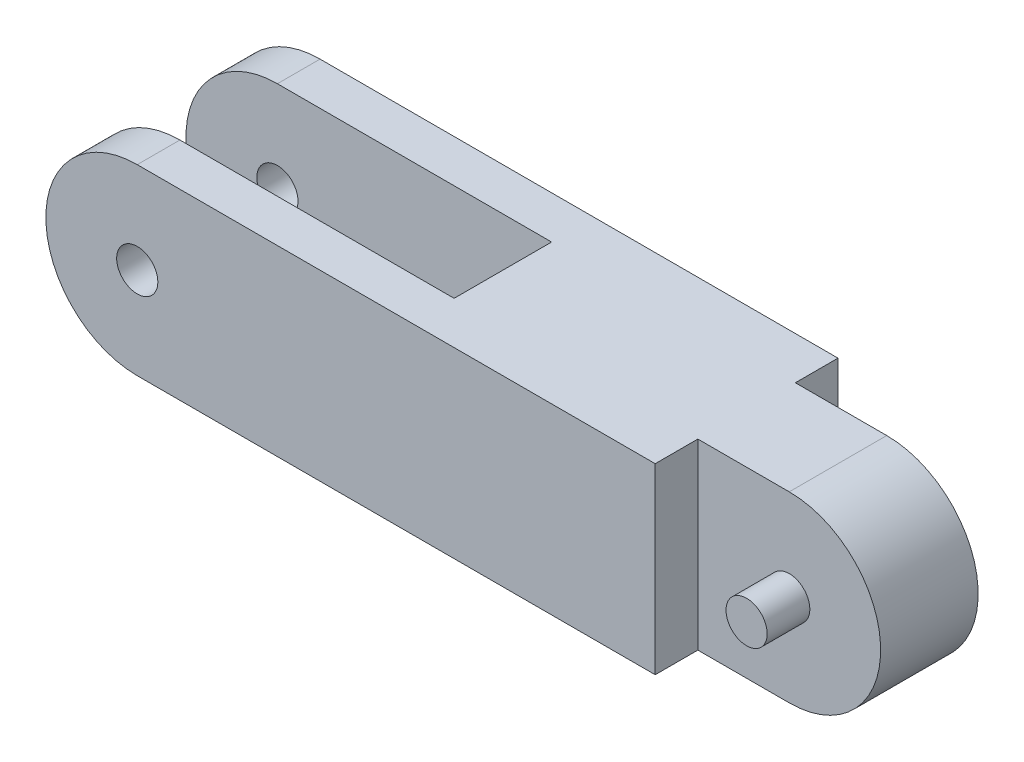
from build123d import *

# Parameters (mm, degrees)
BOSS_EXTRUDE1_DEPTH             = 15
H_0_266_DIAMETER_HOLE1_D        = 6.7564
SKETCH5_W                       = 60
SKETCH5_H                       = 16
SKETCH5_H_2                     = 20.916111238
CUT_EXTRUDE1_DEPTH              = 74.143694192
BOSS_EXTRUDE2_REACH             = 70.374
SKETCH6_R                       = 3.3782
BOSS_EXTRUDE2_DIRECTION_2_REACH = 70.374


with BuildPart() as part:
    # Sketch1 → Boss-Extrude1 (new, symmetric)
    with BuildSketch(Plane.XY):
        with BuildLine():
            Line((-50, 15), (50, 15))
            ThreePointArc((50, 15), (65, 0), (50, -15))
            Line((50, -15), (-50, -15))
            ThreePointArc((-50, -15), (-65, 0), (-50, 15))
        make_face()
    extrude(amount=BOSS_EXTRUDE1_DEPTH, both=True)

    # H (0.266) Diameter Hole1 (through all)
    with Locations(Plane.XY.offset(15)):
        with Locations((-50, 0), (50, 0)):
            Hole(H_0_266_DIAMETER_HOLE1_D / 2)

    # Sketch5 → Cut-Extrude1 (cut, through all)
    with BuildSketch(Plane(origin=(0, 15, 0), x_dir=(1, 0, 0), z_dir=(0, 1, 0))):
        with Locations((-35, 0)):
            Rectangle(SKETCH5_W, SKETCH5_H)
        with Locations((65, 18.458055619)):
            Rectangle(SKETCH5_W, SKETCH5_H_2)
        with Locations((65, -18.458055619)):
            Rectangle(SKETCH5_W, SKETCH5_H_2)
    extrude(amount=-CUT_EXTRUDE1_DEPTH, mode=Mode.SUBTRACT)

    # Boss-Extrude2: up to this face of the body (flat: up to its plane)
    boss_extrude2_end = Plane(part.part.faces().sort_by_distance((-12.991398112, 0, 15))[0])
    # Sketch6 → Boss-Extrude2 (add, up to the picked face)
    with BuildSketch(Plane.XY, mode=Mode.PRIVATE) as boss_extrude2_sk1:
        with Locations((50, 0)):
            Circle(SKETCH6_R)
    boss_extrude2_tool1 = split(extrude(boss_extrude2_sk1.sketch, amount=BOSS_EXTRUDE2_REACH, mode=Mode.PRIVATE), bisect_by=boss_extrude2_end, keep=Keep.BOTH, mode=Mode.PRIVATE)
    add(boss_extrude2_tool1.solids().sort_by(Axis((50, 0, 0), (0, 0, 1)))[0])

    # Boss-Extrude2 direction 2: up to this face of the body (flat: up to its plane)
    boss_extrude2_direction_2_end = Plane(part.part.faces().sort_by_distance((-12.991398112, 0, -15))[0])
    # Sketch6 → Boss-Extrude2 direction 2 (add, up to the picked face)
    with BuildSketch(Plane.XY, mode=Mode.PRIVATE) as boss_extrude2_direction_2_sk1:
        with Locations((50, 0)):
            Circle(SKETCH6_R)
    boss_extrude2_direction_2_tool1 = split(extrude(boss_extrude2_direction_2_sk1.sketch, amount=-BOSS_EXTRUDE2_DIRECTION_2_REACH, mode=Mode.PRIVATE), bisect_by=boss_extrude2_direction_2_end, keep=Keep.BOTH, mode=Mode.PRIVATE)
    add(boss_extrude2_direction_2_tool1.solids().sort_by(Axis((50, 0, 0), (0, 0, -1)))[0])


solid = part.part
